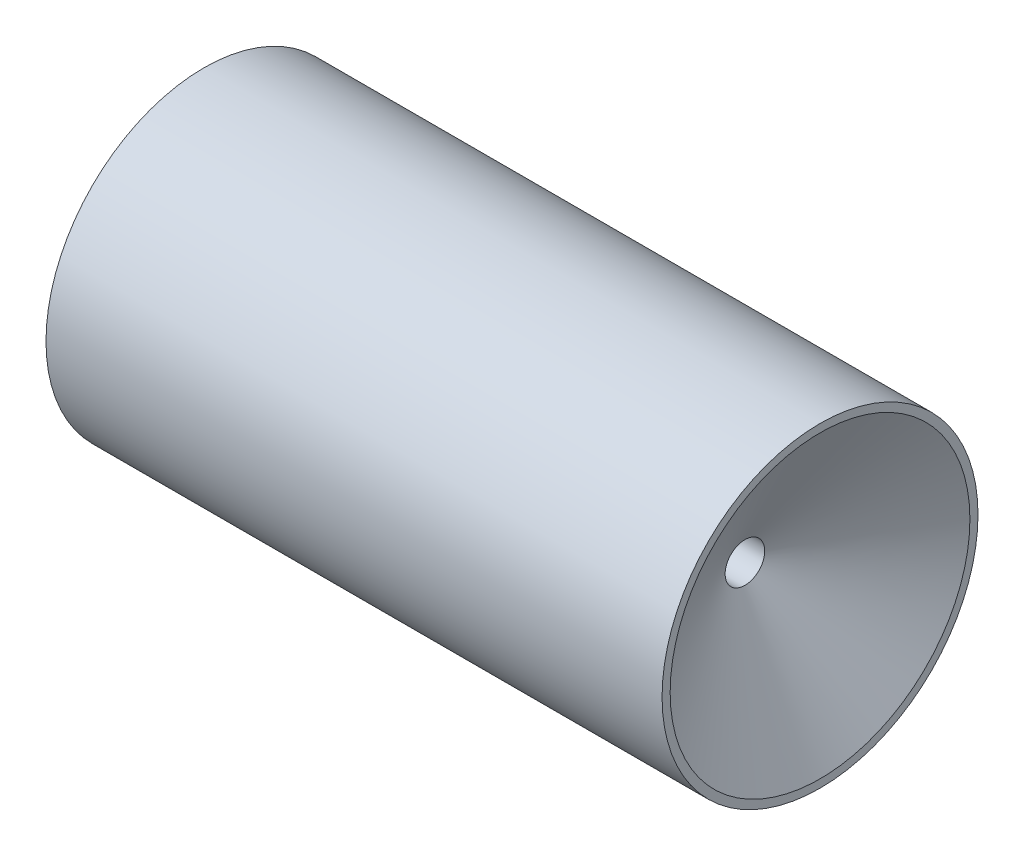
from build123d import *


with BuildPart() as part:
    # Sketch1 → Revolve1 (revolve)
    with BuildSketch(Plane.XY, mode=Mode.PRIVATE) as revolve1_sk:
        Polygon((-78, 20), (0, 20), (0, 18.976056961), (-9.508419399, 2.506991463), (-50.035711439, 2.506991463), (-78, 10), align=None)
    revolve(revolve1_sk.sketch.rotate(Axis((11.272384543, 0, 0), (-1, 0, 0)), 90), axis=Axis((11.272384543, 0, 0), (-1, 0, 0)))


solid = part.part
